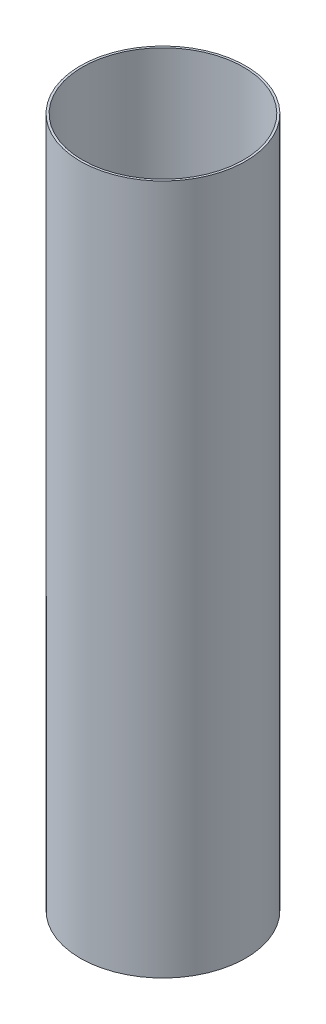
from build123d import *

# Parameters (mm, degrees)
SKETCH1_R           = 1095.375
SKETCH1_R_2         = 1066.8
BOSS_EXTRUDE1_DEPTH = 9144


with BuildPart() as part:
    # Sketch1 → Boss-Extrude1 (new body)
    with BuildSketch(Plane(origin=(0, 0, 0), x_dir=(1, 0, 0), z_dir=(0, 1, 0))):
        with Locations(Location((0, 0, 0), (0, 0, 270))):
            Circle(SKETCH1_R)
        with Locations(Location((0, 0, 0), (0, 0, 270))):
            Circle(SKETCH1_R_2, mode=Mode.SUBTRACT)
    extrude(amount=BOSS_EXTRUDE1_DEPTH)


solid = part.part
